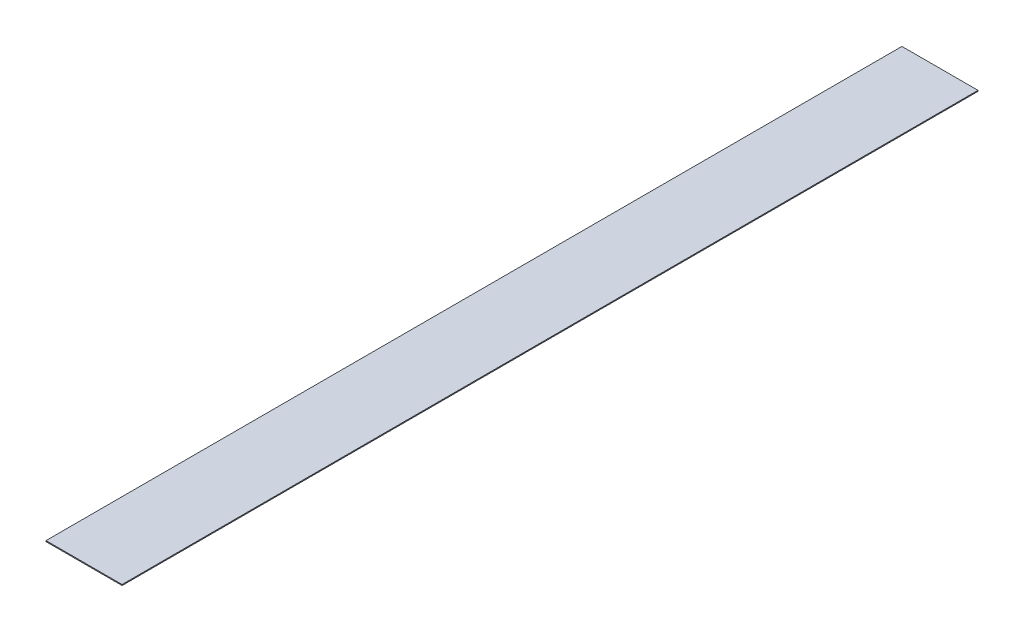
from build123d import *

# Parameters (mm, degrees)
SKETCH2_W           = 4
SKETCH2_H           = 45
BOSS_EXTRUDE1_DEPTH = 0.025


with BuildPart() as part:
    # Sketch2 → Boss-Extrude1 (new, symmetric)
    with BuildSketch(Plane(origin=(0, 0, 0), x_dir=(1, 0, 0), z_dir=(0, 1, 0))):
        Rectangle(SKETCH2_W, SKETCH2_H)
    extrude(amount=BOSS_EXTRUDE1_DEPTH, both=True)


solid = part.part
